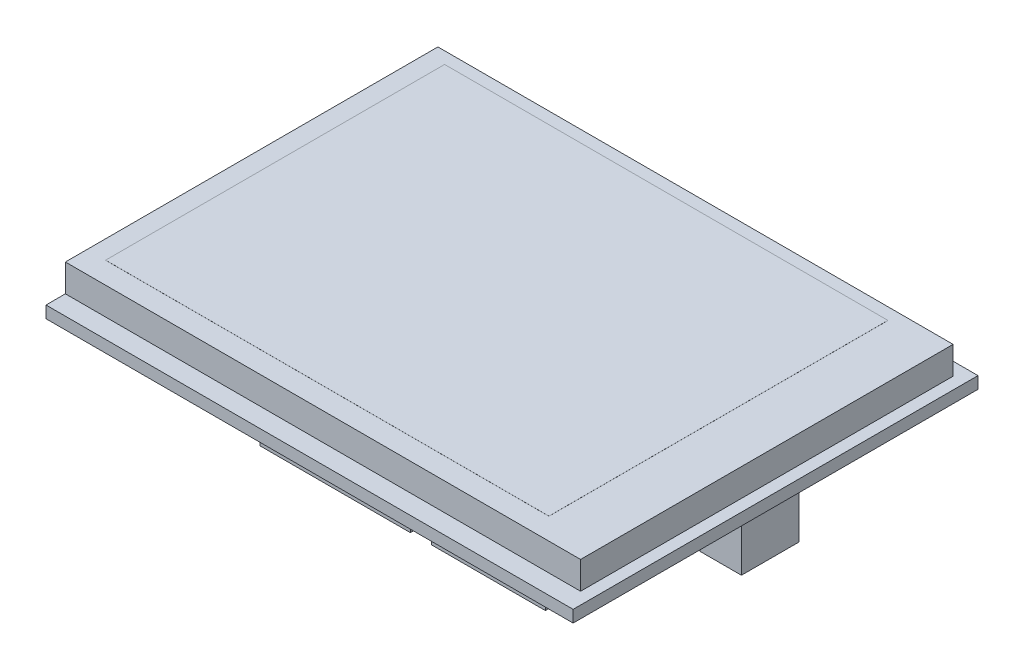
from build123d import *

# Parameters (mm, degrees)
SKETCH1_W           = 70.75
SKETCH1_H           = 54.34
PCB_DEPTH           = 1.6
SKETCH2_W           = 69.15
SKETCH2_H           = 50
SCREEN_DEPTH        = 3.7
SKETCH3_W           = 59.5
SKETCH3_H           = 45.5
USABLE_SPACE_DEPTH  = 0.01
SKETCH4_W           = 16.823482751
SKETCH4_H           = 14.30589821
SD_SLOT_DEPTH       = 2.8
SKETCH6_W           = 6.52491574
SKETCH6_H           = 6.37715793
RESET_BUTTON_DEPTH  = 2.19
BOSS_EXTRUDE6_DEPTH = 1.23
SKETCH8_W           = 5.544724278
SKETCH8_H           = 7.737048543
BOSS_EXTRUDE7_DEPTH = 7.75
SKETCH9_W           = 20.155505067
SKETCH9_H           = 2.546724467
SKETCH9_W_2         = 15.280346801
SKETCH9_W_3         = 25.321717556
SKETCH9_H_2         = 2.837778691
SKETCH9_W_4         = 20.737613516
PINS_DEPTH          = 2.15


with BuildPart() as part:
    # Sketch1 → PCB (new body)
    with BuildSketch(Plane(origin=(0, 0, 0), x_dir=(1, 0, 0), z_dir=(0, 1, 0))):
        with Locations((35.375, 27.17)):
            Rectangle(SKETCH1_W, SKETCH1_H)
    extrude(amount=PCB_DEPTH)

    # Sketch2 → Screen (add)
    with BuildSketch(Plane(origin=(0, 1.6, 0), x_dir=(1, 0, 0), z_dir=(0, 1, 0))):
        with Locations((34.575, 27.6)):
            Rectangle(SKETCH2_W, SKETCH2_H)
    extrude(amount=SCREEN_DEPTH)

    # Sketch3 → usable space (add)
    with BuildSketch(Plane(origin=(0, 5.3, 0), x_dir=(1, 0, 0), z_dir=(0, 1, 0))):
        with Locations((32.25, 28.25)):
            Rectangle(SKETCH3_W, SKETCH3_H)
    extrude(amount=USABLE_SPACE_DEPTH)

    # Sketch4 → SD slot (add)
    with BuildSketch(Plane.XZ):
        with Locations((8.411741376, -22.818507851)):
            Rectangle(SKETCH4_W, SKETCH4_H)
    extrude(amount=SD_SLOT_DEPTH)

    # Sketch6 → reset button (add)
    with BuildSketch(Plane.XZ):
        with Locations((5.542908416, -51.151421035)):
            Rectangle(SKETCH6_W, SKETCH6_H)
    extrude(amount=RESET_BUTTON_DEPTH)

    # Sketch7 → Boss-Extrude6 (add)
    with BuildSketch(Plane.XZ.offset(2.19)):
        with BuildLine():
            ThreePointArc((5.542908416, -49.571421035), (4.425679702, -50.034192321), (3.962908416, -51.151421035))
            Line((3.962908416, -51.151421035), (5.542908416, -51.151421035))
            Line((5.542908416, -51.151421035), (5.542908416, -49.571421035))
        make_face()
        with BuildLine():
            Line((5.542908416, -51.151421035), (3.962908416, -51.151421035))
            ThreePointArc((3.962908416, -51.151421035), (4.425679702, -52.268649749), (5.542908416, -52.731421035))
            Line((5.542908416, -52.731421035), (5.542908416, -51.151421035))
        make_face()
        with BuildLine():
            Line((5.542908416, -49.571421035), (5.542908416, -51.151421035))
            Line((5.542908416, -51.151421035), (7.122908416, -51.151421035))
            ThreePointArc((7.122908416, -51.151421035), (6.66013713, -50.034192321), (5.542908416, -49.571421035))
        make_face()
        with BuildLine():
            Line((7.122908416, -51.151421035), (5.542908416, -51.151421035))
            Line((5.542908416, -51.151421035), (5.542908416, -52.731421035))
            ThreePointArc((5.542908416, -52.731421035), (6.66013713, -52.268649749), (7.122908416, -51.151421035))
        make_face()
    extrude(amount=BOSS_EXTRUDE6_DEPTH)

    # Sketch8 → Boss-Extrude7 (add)
    with BuildSketch(Plane.XZ):
        with Locations((65.962973945, -28.471475729)):
            Rectangle(SKETCH8_W, SKETCH8_H)
    extrude(amount=BOSS_EXTRUDE7_DEPTH)

    # Sketch9 → pins (add)
    with BuildSketch(Plane.XZ):
        with Locations((37.084943571, -3.012499342)):
            Rectangle(SKETCH9_W, SKETCH9_H)
        with Locations((57.640648197, -3.012499342)):
            Rectangle(SKETCH9_W_2, SKETCH9_H)
        with Locations((30.572605291, -51.764081995)):
            Rectangle(SKETCH9_W_3, SKETCH9_H_2)
        with Locations((55.421359732, -51.764081995)):
            Rectangle(SKETCH9_W_4, SKETCH9_H_2)
    extrude(amount=PINS_DEPTH)


solid = part.part
